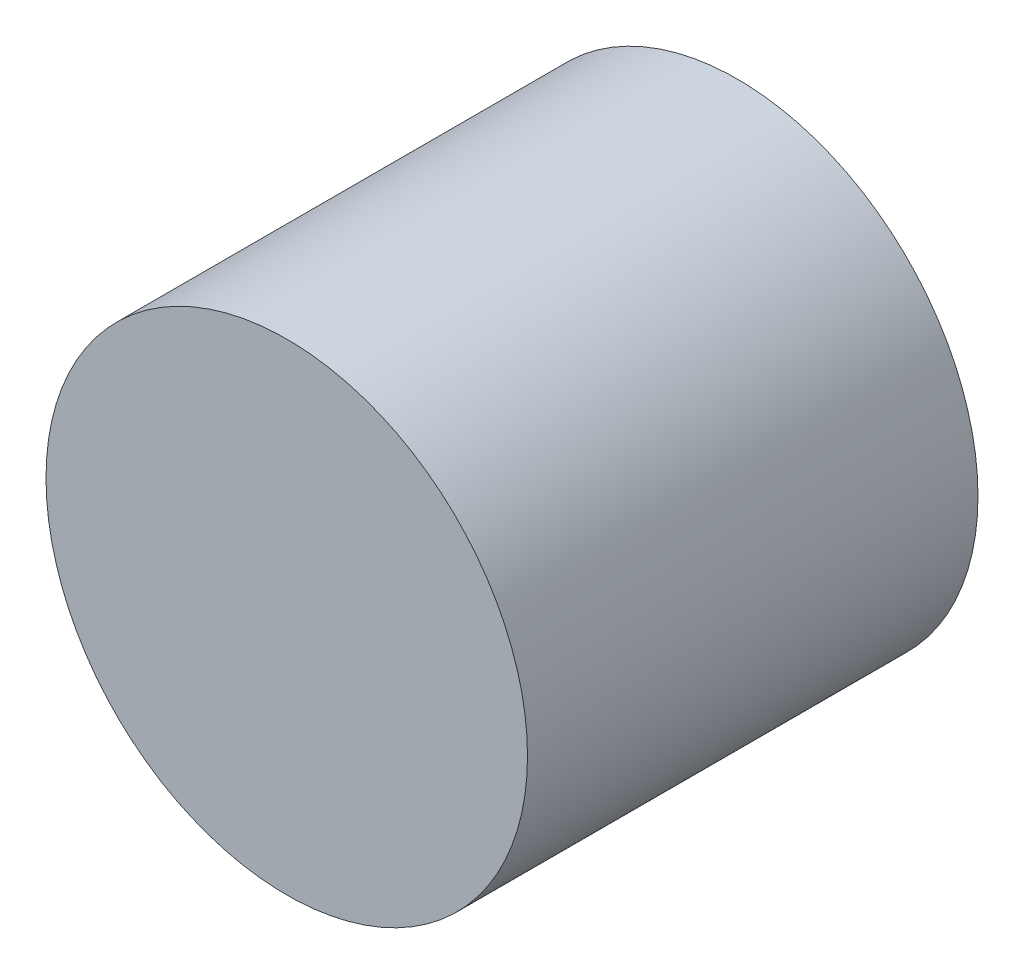
from build123d import *

# Parameters (mm, degrees)
SKETCH1_R           = 2.5
BOSS_EXTRUDE1_DEPTH = 4.67766733


with BuildPart() as part:
    # Sketch1 → Boss-Extrude1 (new body)
    with BuildSketch(Plane.XY):
        Circle(SKETCH1_R)
    extrude(amount=BOSS_EXTRUDE1_DEPTH)


solid = part.part
